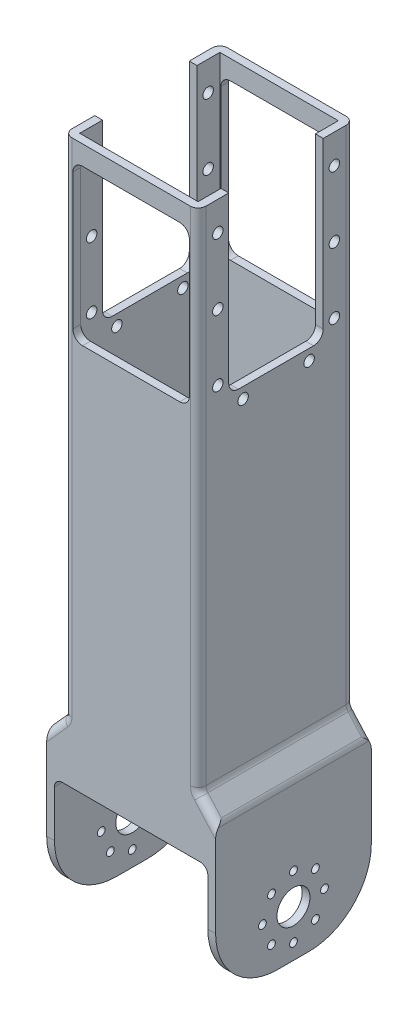
from build123d import *

# Parameters (mm, degrees)
SKETCH1_W               = 43.5
SKETCH1_H               = 40.1
SKETCH1_W_2             = 39.5
SKETCH1_H_2             = 36.1
BOSS_EXTRUDE1_DEPTH     = 40
SKETCH3_R               = 1
SKETCH3_R_2             = 4.25
CUT_EXTRUDE2_DEPTH      = 63.403946189
SKETCH4_W               = 39.5
SKETCH4_H               = 30
CUT_EXTRUDE3_DEPTH      = 61.671842728
FILLET1_R               = 16
SKETCH12_W              = 34.5
SKETCH12_H              = 40.1
SKETCH12_W_2            = 30.5
SKETCH12_H_2            = 36.1
BOSS_EXTRUDE2_DEPTH     = 130
CUT_EXTRUDE4_DEPTH      = 181.41064976
CUT_EXTRUDE4_DEPTH_BACK = 181.41064976
SKETCH5_W               = 24.33649167
SKETCH5_H               = 45
SKETCH6_W               = 30
SKETCH6_H               = 40
CUT_EXTRUDE5_DEPTH      = 181.848203053
FILLET2_R               = 2
FILLET3_R               = 2.5
SKETCH16_R              = 1.35
CUT_EXTRUDE6_DEPTH      = 181.41064976


with BuildPart() as part:
    # Sketch1 → Boss-Extrude1 (new body)
    with BuildSketch(Plane(origin=(0, 0, 0), x_dir=(1, 0, 0), z_dir=(0, 1, 0))):
        Rectangle(SKETCH1_W, SKETCH1_H)
        Rectangle(SKETCH1_W_2, SKETCH1_H_2, mode=Mode.SUBTRACT)
    extrude(amount=BOSS_EXTRUDE1_DEPTH)

    # Sketch3 → Cut-Extrude2 (cut, through all)
    with BuildSketch(Plane(origin=(21.75, 0, 0), x_dir=(0, 0, -1), z_dir=(1, 0, 0))):
        with Locations((0, 20)):
            Circle(SKETCH3_R)
        with Locations((5.656854249, 17.656854249)):
            Circle(SKETCH3_R)
        with Locations((8, 12)):
            Circle(SKETCH3_R)
        with Locations((5.656854249, 6.343145751)):
            Circle(SKETCH3_R)
        with Locations((0, 4)):
            Circle(SKETCH3_R)
        with Locations((-5.656854249, 6.343145751)):
            Circle(SKETCH3_R)
        with Locations((-8, 12)):
            Circle(SKETCH3_R)
        with Locations((-5.656854249, 17.656854249)):
            Circle(SKETCH3_R)
        with Locations((0, 12)):
            Circle(SKETCH3_R_2)
    extrude(amount=-CUT_EXTRUDE2_DEPTH, mode=Mode.SUBTRACT)

    # Sketch4 → Cut-Extrude3 (cut, through all)
    with BuildSketch(Plane.XY.offset(20.05)):
        with Locations((0, 15)):
            Rectangle(SKETCH4_W, SKETCH4_H)
    extrude(amount=-CUT_EXTRUDE3_DEPTH, mode=Mode.SUBTRACT)

    # Fillet1
    fillet1_edges = [part.edges().sort_by_distance(p)[0] for p in [
        (20.75, 0, 20.05),
        (-20.75, 0, -20.05),
        (-20.75, 0, 20.05),
        (20.75, 0, -20.05),
    ]]
    fillet(fillet1_edges, radius=FILLET1_R)

    # Sketch8 → Loft2 section 0
    with BuildSketch(Plane(origin=(0, 40, 0), x_dir=(1, 0, 0), z_dir=(0, 1, 0))):
        with BuildLine():
            Line((-21.75, -20.05), (21.75, -20.05))
            Line((21.75, -20.05), (21.75, 20.05))
            Line((21.75, 20.05), (-21.75, 20.05))
            Line((-21.75, 20.05), (-21.75, -20.05))
        make_face()
    # Sketch7 → Loft2 section 1
    with BuildSketch(Plane(origin=(0, 45, 0), x_dir=(1, 0, 0), z_dir=(0, 1, 0))):
        with BuildLine():
            Line((-17.25, -20.05), (17.25, -20.05))
            Line((17.25, -20.05), (17.25, 20.05))
            Line((17.25, 20.05), (-17.25, 20.05))
            Line((-17.25, 20.05), (-17.25, -20.05))
        make_face()
    loft()

    # Sketch11 → Cut-Loft1 section 0
    with BuildSketch(Plane(origin=(0, 45, 0), x_dir=(1, 0, 0), z_dir=(0, 1, 0))):
        with BuildLine():
            Line((-15.25, -18.05), (-15.25, 18.05))
            Line((-15.25, 18.05), (15.25, 18.05))
            Line((15.25, 18.05), (15.25, -18.05))
            Line((15.25, -18.05), (-15.25, -18.05))
        make_face()
    # Sketch10 → Cut-Loft1 section 1
    with BuildSketch(Plane(origin=(0, 40, 0), x_dir=(1, 0, 0), z_dir=(0, 1, 0))):
        with BuildLine():
            Line((-19.75, -18.05), (19.75, -18.05))
            Line((19.75, -18.05), (19.75, 18.05))
            Line((19.75, 18.05), (-19.75, 18.05))
            Line((-19.75, 18.05), (-19.75, -18.05))
        make_face()
    loft(mode=Mode.SUBTRACT)

    # Sketch12 → Boss-Extrude2 (add)
    with BuildSketch(Plane(origin=(0, 45, 0), x_dir=(1, 0, 0), z_dir=(0, 1, 0))):
        Rectangle(SKETCH12_W, SKETCH12_H)
        Rectangle(SKETCH12_W_2, SKETCH12_H_2, mode=Mode.SUBTRACT)
    extrude(amount=BOSS_EXTRUDE2_DEPTH)

    # Sketch5 → Cut-Extrude4 (cut, two sides: drawn at the far end of the back side and taken through both)
    with BuildSketch(Plane.ZY.offset(17.25).offset(-CUT_EXTRUDE4_DEPTH_BACK)):
        with Locations((0, 152.5)):
            Rectangle(SKETCH5_W, SKETCH5_H)
    extrude(amount=CUT_EXTRUDE4_DEPTH + CUT_EXTRUDE4_DEPTH_BACK, mode=Mode.SUBTRACT)

    # Sketch6 → Cut-Extrude5 (cut, through all)
    with BuildSketch(Plane.XY.offset(20.05)):
        with Locations((0, 150)):
            Rectangle(SKETCH6_W, SKETCH6_H)
    extrude(amount=-CUT_EXTRUDE5_DEPTH, mode=Mode.SUBTRACT)

    # Fillet2
    fillet2_edges = [part.edges().sort_by_distance(p)[0] for p in [
        (-19.75, 30, 19.05),
        (19.75, 30, 19.05),
        (19.75, 30, -19.05),
        (-19.75, 30, -19.05),
        (-21.75, 40, 0),
        (17.25, 45, 0),
        (-17.25, 45, 0),
        (19.5, 42.5, 20.05),
        (-19.5, 42.5, 20.05),
        (19.5, 42.5, -20.05),
        (-19.5, 42.5, -20.05),
        (17.25, 110, -20.05),
        (-17.25, 110, -20.05),
        (-17.25, 110, 20.05),
        (17.25, 110, 20.05),
        (21.75, 40, 0),
    ]]
    fillet(fillet2_edges, radius=FILLET2_R)

    # Fillet3
    fillet3_edges = [part.edges().sort_by_distance(p)[0] for p in [
        (-19.75, 40, 0),
        (19.75, 40, 0),
        (15.25, 45, 0),
        (-15.25, 45, 0),
        (16.25, 130, -12.168245835),
        (16.25, 130, 12.168245835),
        (-15, 170, -19.05),
        (-15, 130, -19.05),
        (-16.25, 130, 12.168245835),
        (-16.25, 130, -12.168245835),
        (15, 130, -19.05),
        (15, 170, -19.05),
        (15, 170, 19.05),
        (-15, 170, 19.05),
        (-15, 130, 19.05),
        (15, 130, 19.05),
    ]]
    fillet(fillet3_edges, radius=FILLET3_R)

    # Sketch16 → Cut-Extrude6 (cut, through all)
    with BuildSketch(Plane.ZY.offset(17.25)):
        with Locations((-15.031754165, 167.5)):
            Circle(SKETCH16_R)
        with Locations((-15.031754165, 150.5)):
            Circle(SKETCH16_R)
        with Locations((-15.031754165, 133.5)):
            Circle(SKETCH16_R)
        with Locations((-8.531754165, 127.2)):
            Circle(SKETCH16_R)
        with Locations((8.468245835, 127.2)):
            Circle(SKETCH16_R)
        with Locations((14.968245835, 133.5)):
            Circle(SKETCH16_R)
        with Locations((14.968245835, 150.5)):
            Circle(SKETCH16_R)
        with Locations((14.968245835, 167.5)):
            Circle(SKETCH16_R)
    extrude(amount=-CUT_EXTRUDE6_DEPTH, mode=Mode.SUBTRACT)


solid = part.part
